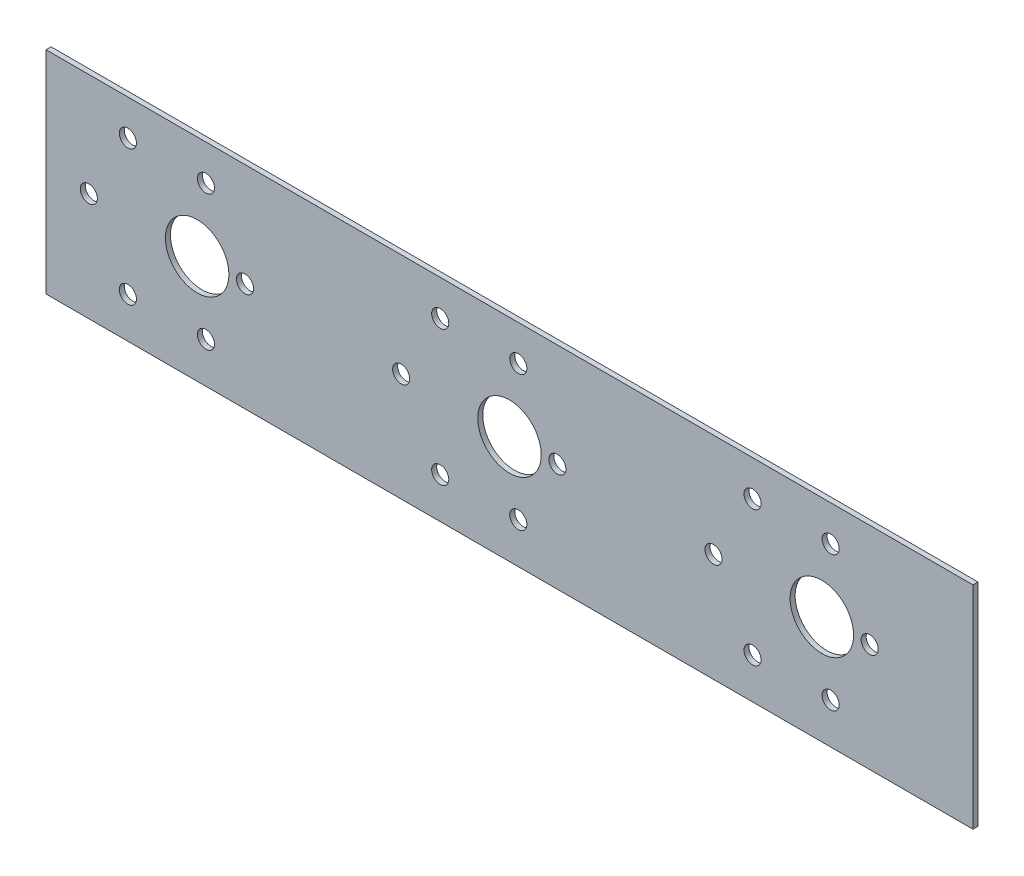
from build123d import *

# Parameters (mm, degrees)
BOSS_BORES_AND_POSITIVE_GEARBOX_MOUN_2_W       = 184
BOSS_BORES_AND_POSITIVE_GEARBOX_MOUN_2_H       = 42
BOSS_BORES_AND_POSITIVE_GEARBOX_MOUN_2_R       = 6.3
BOSS_BORES_AND_POSITIVE_GEARBOX_MOUN_2_R_2     = 1.7
BOSS_BORES_AND_POSITIVE_GEARBOX_MOUNTING_DEPTH = 1


with BuildPart() as part:
    # Boss bores and positive gearbox moun 2 → Boss bores and positive gearbox mounting (new body)
    with BuildSketch(Plane.XY):
        with Locations((0, 28)):
            Rectangle(BOSS_BORES_AND_POSITIVE_GEARBOX_MOUN_2_W, BOSS_BORES_AND_POSITIVE_GEARBOX_MOUN_2_H)
        with Locations((-62, 28.5)):
            Circle(BOSS_BORES_AND_POSITIVE_GEARBOX_MOUN_2_R, mode=Mode.SUBTRACT)
        with Locations((0, 28.5)):
            Circle(BOSS_BORES_AND_POSITIVE_GEARBOX_MOUN_2_R, mode=Mode.SUBTRACT)
        with Locations((62, 28.5)):
            Circle(BOSS_BORES_AND_POSITIVE_GEARBOX_MOUN_2_R, mode=Mode.SUBTRACT)
        with Locations((-52.5, 28.5)):
            Circle(BOSS_BORES_AND_POSITIVE_GEARBOX_MOUN_2_R_2, mode=Mode.SUBTRACT)
        with Locations((-60.25, 41.923393759)):
            Circle(BOSS_BORES_AND_POSITIVE_GEARBOX_MOUN_2_R_2, mode=Mode.SUBTRACT)
        with Locations((-75.75, 41.923393759)):
            Circle(BOSS_BORES_AND_POSITIVE_GEARBOX_MOUN_2_R_2, mode=Mode.SUBTRACT)
        with Locations((-83.5, 28.5)):
            Circle(BOSS_BORES_AND_POSITIVE_GEARBOX_MOUN_2_R_2, mode=Mode.SUBTRACT)
        with Locations((-75.75, 15.076606241)):
            Circle(BOSS_BORES_AND_POSITIVE_GEARBOX_MOUN_2_R_2, mode=Mode.SUBTRACT)
        with Locations((-60.25, 15.076606241)):
            Circle(BOSS_BORES_AND_POSITIVE_GEARBOX_MOUN_2_R_2, mode=Mode.SUBTRACT)
        with Locations((9.5, 28.5)):
            Circle(BOSS_BORES_AND_POSITIVE_GEARBOX_MOUN_2_R_2, mode=Mode.SUBTRACT)
        with Locations((1.75, 41.923393759)):
            Circle(BOSS_BORES_AND_POSITIVE_GEARBOX_MOUN_2_R_2, mode=Mode.SUBTRACT)
        with Locations((-13.75, 41.923393759)):
            Circle(BOSS_BORES_AND_POSITIVE_GEARBOX_MOUN_2_R_2, mode=Mode.SUBTRACT)
        with Locations((-21.5, 28.5)):
            Circle(BOSS_BORES_AND_POSITIVE_GEARBOX_MOUN_2_R_2, mode=Mode.SUBTRACT)
        with Locations((-13.75, 15.076606241)):
            Circle(BOSS_BORES_AND_POSITIVE_GEARBOX_MOUN_2_R_2, mode=Mode.SUBTRACT)
        with Locations((1.75, 15.076606241)):
            Circle(BOSS_BORES_AND_POSITIVE_GEARBOX_MOUN_2_R_2, mode=Mode.SUBTRACT)
        with Locations((71.5, 28.5)):
            Circle(BOSS_BORES_AND_POSITIVE_GEARBOX_MOUN_2_R_2, mode=Mode.SUBTRACT)
        with Locations((63.75, 41.923393759)):
            Circle(BOSS_BORES_AND_POSITIVE_GEARBOX_MOUN_2_R_2, mode=Mode.SUBTRACT)
        with Locations((48.25, 41.923393759)):
            Circle(BOSS_BORES_AND_POSITIVE_GEARBOX_MOUN_2_R_2, mode=Mode.SUBTRACT)
        with Locations((40.5, 28.5)):
            Circle(BOSS_BORES_AND_POSITIVE_GEARBOX_MOUN_2_R_2, mode=Mode.SUBTRACT)
        with Locations((48.25, 15.076606241)):
            Circle(BOSS_BORES_AND_POSITIVE_GEARBOX_MOUN_2_R_2, mode=Mode.SUBTRACT)
        with Locations((63.75, 15.076606241)):
            Circle(BOSS_BORES_AND_POSITIVE_GEARBOX_MOUN_2_R_2, mode=Mode.SUBTRACT)
    extrude(amount=BOSS_BORES_AND_POSITIVE_GEARBOX_MOUNTING_DEPTH)


solid = part.part
